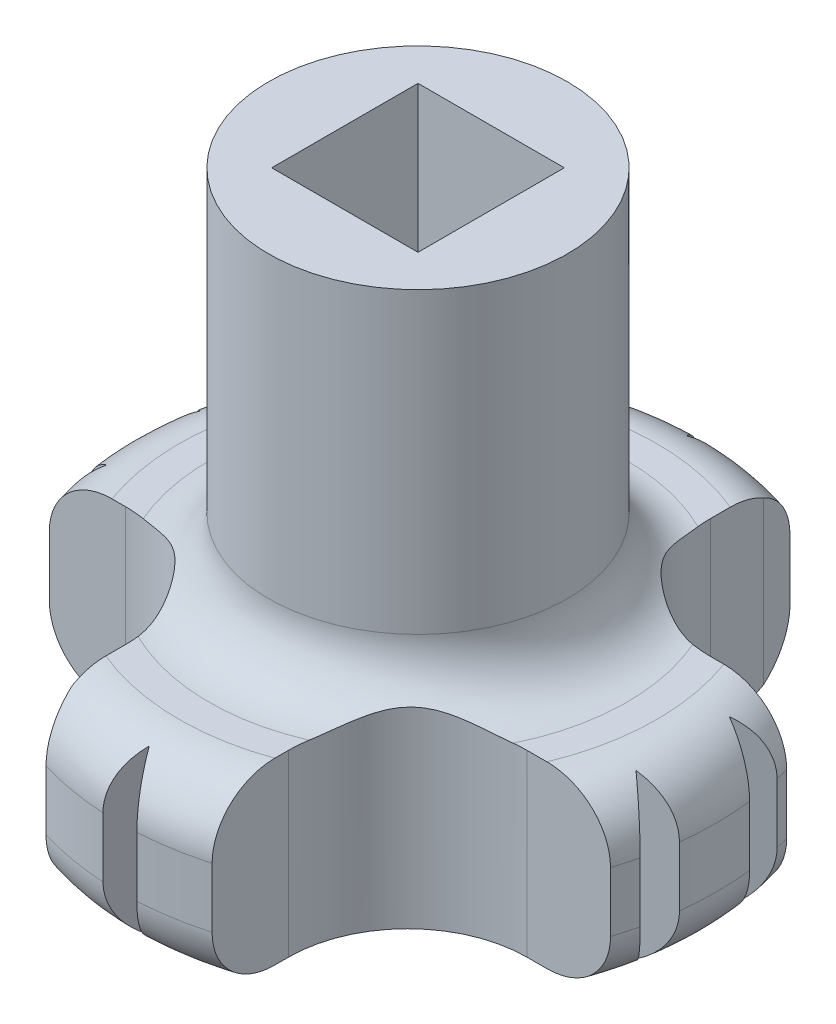
from build123d import *

# Parameters (mm, degrees)
SKETCH2_W          = 2.45
SKETCH2_H          = 2.45
CUT_EXTRUDE1_DEPTH = 3
CUT_EXTRUDE2_DEPTH = 3
CUT_EXTRUDE3_DEPTH = 10.269268467
CIRPATTERN1_COUNT  = 4


with BuildPart() as part:
    # Sketch1 → Revolve1 (revolve)
    with BuildSketch(Plane(origin=(0, 0, 0), x_dir=(0, 0, -1), z_dir=(1, 0, 0))):
        with BuildLine():
            Line((0, 9), (2.5, 9))
            Line((2.5, 9), (2.5, 4))
            ThreePointArc((2.5, 4), (2.792893219, 3.292893219), (3.5, 3))
            Line((3.5, 3), (4, 3))
            ThreePointArc((4, 3), (4.707106781, 2.707106781), (5, 2))
            Line((5, 2), (5, 1))
            ThreePointArc((5, 1), (4.707106781, 0.292893219), (4, 0))
            Line((4, 0), (0, 0))
            Line((0, 0), (0, 9))
        make_face()
    revolve(axis=Axis((0, 0, 0), (0, 1, 0)))

    # Sketch2 → Cut-Extrude1 (cut)
    with BuildSketch(Plane(origin=(0, 9, 0), x_dir=(1, 0, 0), z_dir=(0, 1, 0))):
        Rectangle(SKETCH2_W, SKETCH2_H)
    extrude(amount=-CUT_EXTRUDE1_DEPTH, mode=Mode.SUBTRACT)

    # Sketch3 → Cut-Extrude2 (cut)
    with BuildSketch(Plane(origin=(0, 3, 0), x_dir=(1, 0, 0), z_dir=(0, 1, 0))):
        Polygon((0, 4.5), (-1, 6.232050808), (1, 6.232050808), align=None)
        Polygon((1.539090645, 4.228616794), (1.19179429, 6.1982323), (3.071179531, 5.514192013), align=None)
        Polygon((2.892544244, 3.447199994), (3.239840599, 5.4168155), (4.771929485, 4.131240281), align=None)
        Polygon((3.897114317, 2.25), (4.897114317, 3.982050808), (5.897114317, 2.25), align=None)
        Polygon((4.431634889, 0.7814168), (5.963723775, 2.066992019), (6.31102013, 0.097376513), align=None)
        Polygon((4.431634889, -0.7814168), (6.31102013, -0.097376513), (5.963723775, -2.066992019), align=None)
        Polygon((3.897114317, -2.25), (5.897114317, -2.25), (4.897114317, -3.982050808), align=None)
        Polygon((2.892544244, -3.447199994), (4.771929485, -4.131240281), (3.239840599, -5.4168155), align=None)
        Polygon((1.539090645, -4.228616794), (3.071179531, -5.514192013), (1.19179429, -6.1982323), align=None)
        Polygon((0, -4.5), (1, -6.232050808), (-1, -6.232050808), align=None)
        Polygon((-1.539090645, -4.228616794), (-1.19179429, -6.1982323), (-3.071179531, -5.514192013), align=None)
        Polygon((-2.892544244, -3.447199994), (-3.239840599, -5.4168155), (-4.771929485, -4.131240281), align=None)
        Polygon((-3.897114317, -2.25), (-4.897114317, -3.982050808), (-5.897114317, -2.25), align=None)
        Polygon((-4.431634889, -0.7814168), (-5.963723775, -2.066992019), (-6.31102013, -0.097376513), align=None)
        Polygon((-4.431634889, 0.7814168), (-6.31102013, 0.097376513), (-5.963723775, 2.066992019), align=None)
        Polygon((-3.897114317, 2.25), (-5.897114317, 2.25), (-4.897114317, 3.982050808), align=None)
        Polygon((-2.892544244, 3.447199994), (-4.771929485, 4.131240281), (-3.239840599, 5.4168155), align=None)
        Polygon((-1.539090645, 4.228616794), (-3.071179531, 5.514192013), (-1.19179429, 6.1982323), align=None)
    extrude(amount=-CUT_EXTRUDE2_DEPTH, mode=Mode.SUBTRACT)

    # Sketch4 → Cut-Extrude3 (cut, symmetric)
    with BuildSketch(Plane(origin=(0, 3, 0), x_dir=(1, 0, 0), z_dir=(0, 1, 0))):
        with BuildLine():
            Line((-8.362844882, 8.53515041), (-1.362844882, 8.53515041))
            Line((-1.362844882, 8.53515041), (-1.362844882, 3.53515041))
            ThreePointArc((-1.362844882, 3.53515041), (-1.94863132, 2.120936847), (-3.362844882, 1.53515041))
            Line((-3.362844882, 1.53515041), (-8.362844882, 1.53515041))
            Line((-8.362844882, 1.53515041), (-8.362844882, 8.53515041))
        make_face()
    cut_extrude3 = extrude(amount=CUT_EXTRUDE3_DEPTH, both=True, mode=Mode.SUBTRACT)

    # CirPattern1: Cut-Extrude3 ×4 about axis
    cirpattern1_axis = Axis((0, 0, 0), (0, 1, 0))
    for i in range(1, CIRPATTERN1_COUNT):
        add(cut_extrude3.rotate(cirpattern1_axis, i * 360 / CIRPATTERN1_COUNT), mode=Mode.SUBTRACT)


solid = part.part
